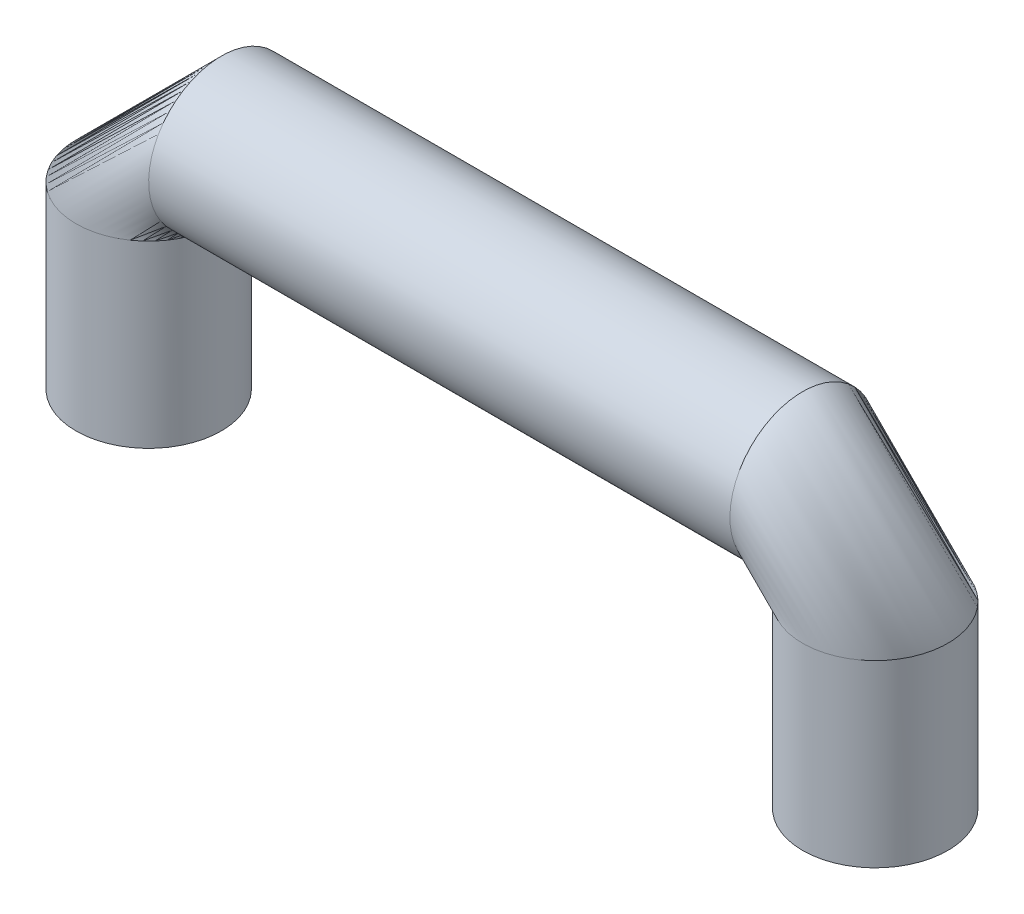
from build123d import *

# Parameters (mm, degrees)
SWEEP5_PROFILE_R = 25.4


with BuildPart() as part:
    # Sweep5: sweep along a path in Sketch1
    with BuildLine(Plane.XY) as sweep5_path:
        Line((0, 0), (0, 62.738))
        ThreePointArc((0, 62.738), (7.439487758, 80.698512242), (25.4, 88.138))
        Line((25.4, 88.138), (228.6, 88.138))
        ThreePointArc((228.6, 88.138), (246.560512242, 80.698512242), (254, 62.738))
        Line((254, 62.738), (254, 0))
    # Sweep5 profile (on start of the path) → Sweep5 (sweep)
    with BuildSketch(Plane.ZX):
        Circle(SWEEP5_PROFILE_R)
    sweep(path=sweep5_path.line)


solid = part.part
